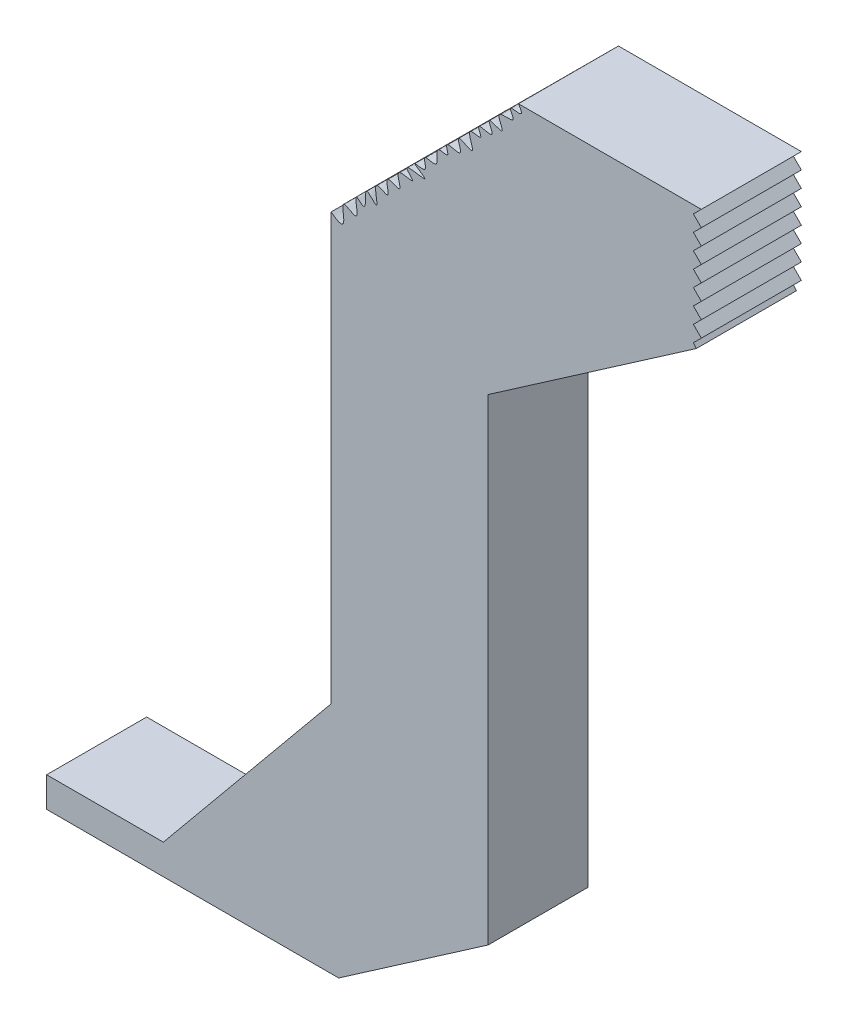
from build123d import *

# Parameters (mm, degrees)
BOSS_EXTRUDE1_DEPTH = 2


with BuildPart() as part:
    # Sketch1 → Boss-Extrude1 (new body)
    with BuildSketch(Plane.XY):
        with BuildLine():
            Line((27.597285827, 24.98016944), (27.437942417, 24.82082603))
            Line((27.437942417, 24.82082603), (27.597285827, 24.661482619))
            Line((27.597285827, 24.661482619), (27.437942417, 24.502139209))
            Line((27.437942417, 24.502139209), (27.597285827, 24.342795798))
            Line((27.597285827, 24.342795798), (27.437942417, 24.183452388))
            Line((27.437942417, 24.183452388), (27.597285827, 24.024108977))
            Line((27.597285827, 24.024108977), (27.437942417, 23.864765566))
            Line((27.437942417, 23.864765566), (27.597285827, 23.705422156))
            Line((27.597285827, 23.705422156), (27.437942417, 23.546078745))
            Line((27.437942417, 23.546078745), (27.597285827, 23.386735335))
            Line((27.597285827, 23.386735335), (27.437942417, 23.227391924))
            Line((27.437942417, 23.227391924), (27.597285827, 23.068048514))
            Line((27.597285827, 23.068048514), (27.437942417, 22.908705103))
            Line((27.437942417, 22.908705103), (27.597285827, 22.749361693))
            Line((27.597285827, 22.749361693), (27.437942417, 22.590018282))
            Line((27.437942417, 22.590018282), (27.496999838, 22.518621593))
            Line((27.496999838, 22.518621593), (24.704486965, 20.588371803))
            Line((24.704486965, 20.588371803), (23.334082448, 19.641116355))
            Line((23.334082448, 19.641116355), (23.334082448, 10.107828937))
            Line((23.334082448, 10.107828937), (20.344771622, 8.041547829))
            Line((20.344771622, 8.041547829), (17.997981037, 8.041547829))
            Line((17.997981037, 8.041547829), (17.497981037, 8.041547829))
            Line((17.497981037, 8.041547829), (14.504775841, 8.041547829))
            Line((14.504775841, 8.041547829), (14.504775841, 8.641547829))
            Line((14.504775841, 8.641547829), (16.838861385, 8.641547829))
            Line((16.838861385, 8.641547829), (20.193762011, 12.714831013))
            Line((20.193762011, 12.714831013), (20.193762011, 14.648921355))
            Line((20.193762011, 14.648921355), (20.193762011, 21.234015946))
            add(Edge.make_bspline(
                [(20.193762011, 21.234015946), (20.630326079, 20.896226809), (20.207011544, 21.755138532), (20.838358118, 21.228767141), (20.589664816, 21.909043014), (20.94287076, 21.500445283), (20.806034301, 22.149110961), (21.227214911, 21.582190664), (20.96164789, 22.326037829), (21.441369386, 21.948480099), (21.193091591, 22.51402248), (21.697024035, 22.174422347), (21.38684954, 22.731518628), (21.978039263, 22.487213764), (21.504571677, 22.882369453), (22.344972241, 22.62239717), (21.693320733, 22.982675486), (22.172739197, 22.821711798), (21.969040643, 23.208800923), (22.414961819, 22.986546391), (22.219387578, 23.485797203), (22.597626033, 23.310514939), (22.407798445, 23.66895302), (22.912603709, 23.404886628), (22.60873727, 23.942293), (23.189264563, 23.517149668), (22.814000792, 24.144042117), (23.279790075, 23.938048407), (23.025422672, 24.303024744), (23.558230063, 24.050355411), (23.216399008, 24.532663237), (23.769025826, 24.199817166), (23.384754432, 24.724376165), (23.96276988, 24.550582896), (23.631981, 24.961128161), (24.129079367, 24.713153373), (23.939915506, 24.98016944)],
                knots=[0, 0, 0, 0, 0.06094789, 0.090020571, 0.127687594, 0.146958509, 0.180987869, 0.20822772, 0.248065155, 0.273087139, 0.30430167, 0.331767474, 0.363052825, 0.394213618, 0.416566098, 0.457513129, 0.486638998, 0.509347074, 0.532055151, 0.556986684, 0.589768541, 0.60988528, 0.628220644, 0.658723687, 0.686122934, 0.71790969, 0.754509135, 0.777526988, 0.796381626, 0.826923256, 0.852066501, 0.881773628, 0.911457795, 0.944242403, 0.96352209, 1, 1, 1, 1], degree=3))
            Line((23.939915506, 24.98016944), (27.597285827, 24.98016944))
        make_face()
    extrude(amount=BOSS_EXTRUDE1_DEPTH)


solid = part.part
